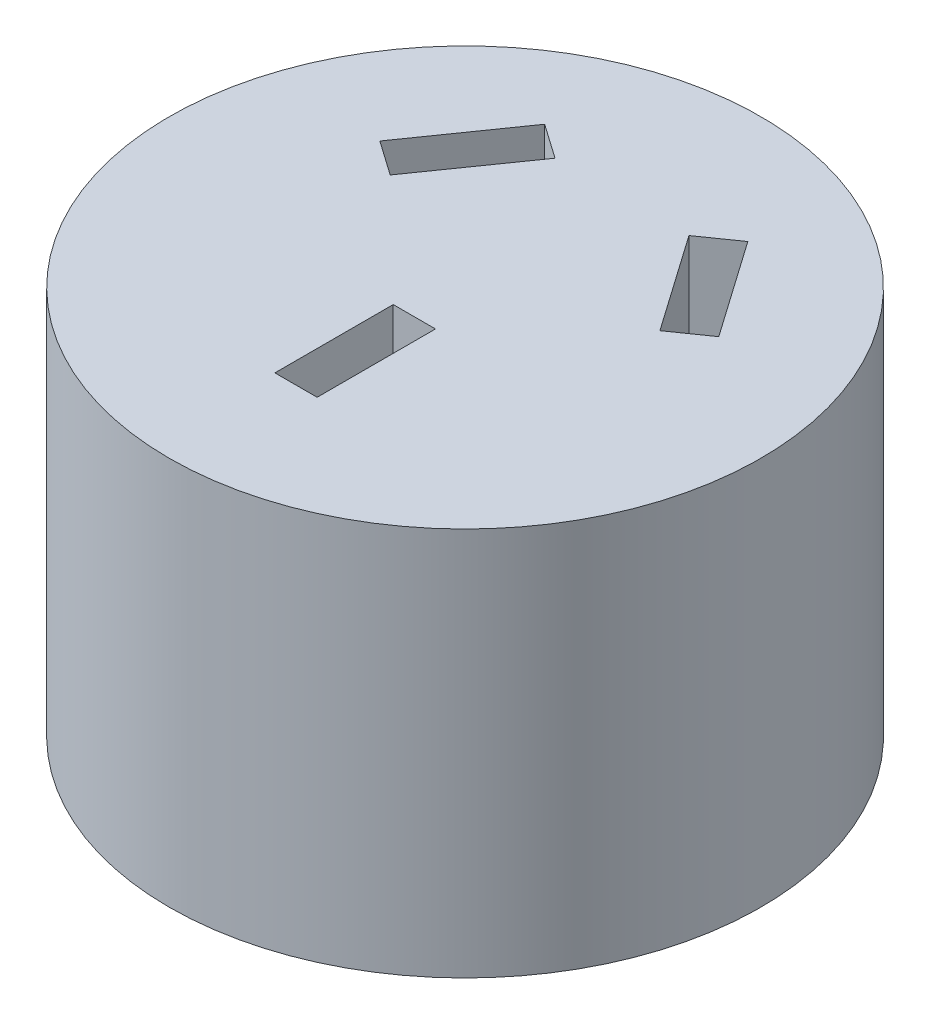
from build123d import *

# Parameters (mm, degrees)
SALIENTE_EXTRUIR1_DEPTH      = 11.5
SALIENTE_EXTRUIR1_DEPTH_BACK = 11.5
CROQUIS1_R                   = 17.5
CROQUIS2_W                   = 2.5
CROQUIS2_H                   = 7
CORTAR_EXTRUIR_L_MINA1_DEPTH = 34.786091813
TALADRO2_D                   = 5.6
TALADRO2_DEPTH               = 7
TALADRO3_D                   = 3
TALADRO3_DEPTH               = 15
TALADRO3_CBORE_D             = 10
TALADRO3_CBORE_DEPTH         = 5


with BuildPart() as part:
    # Croquis1 → Saliente-Extruir1 (new, two sides: drawn at the far end of the back side and taken through both)
    with BuildSketch(Plane(origin=(0, 0, 0), x_dir=(1, 0, 0), z_dir=(0, 1, 0)).offset(-SALIENTE_EXTRUIR1_DEPTH_BACK)):
        Circle(CROQUIS1_R)
    extrude(amount=SALIENTE_EXTRUIR1_DEPTH + SALIENTE_EXTRUIR1_DEPTH_BACK)

    # Croquis2 → Cortar-Extruir-Lámina1 (cut, through all)
    with BuildSketch(Plane(origin=(0, 11.5, 0), x_dir=(1, 0, 0), z_dir=(0, 1, 0))):
        with Locations((0, -6.5)):
            Rectangle(CROQUIS2_W, CROQUIS2_H)
        Polygon((-7.976059945, 3.548965145), (-3.96102489, 9.283029455), (-6.008905001, 10.716970545), (-10.023940055, 4.982906235), align=None)
        Polygon((3.96102489, 9.283029455), (7.976059945, 3.548965145), (10.023940055, 4.982906235), (6.008905001, 10.716970545), align=None)
    extrude(amount=-CORTAR_EXTRUIR_L_MINA1_DEPTH, mode=Mode.SUBTRACT)

    # Taladro2
    with Locations(Plane(origin=(0, -11.5, 0), x_dir=(-1, 0, 0), z_dir=(0, -1, 0))):
        with Locations((-10, -3), (10, -3)):
            Hole(TALADRO2_D / 2, depth=TALADRO2_DEPTH)

    # Taladro3
    with Locations(Plane(origin=(-15.907017578, 1.665123618, 7.294984015), x_dir=(-0.416856229443, 0, -0.908972433011), z_dir=(-0.908972433011, 0, 0.416856229443))):
        with Locations((0, 0)):
            CounterBoreHole(TALADRO3_D / 2, TALADRO3_CBORE_D / 2, TALADRO3_CBORE_DEPTH, depth=TALADRO3_DEPTH)


solid = part.part
